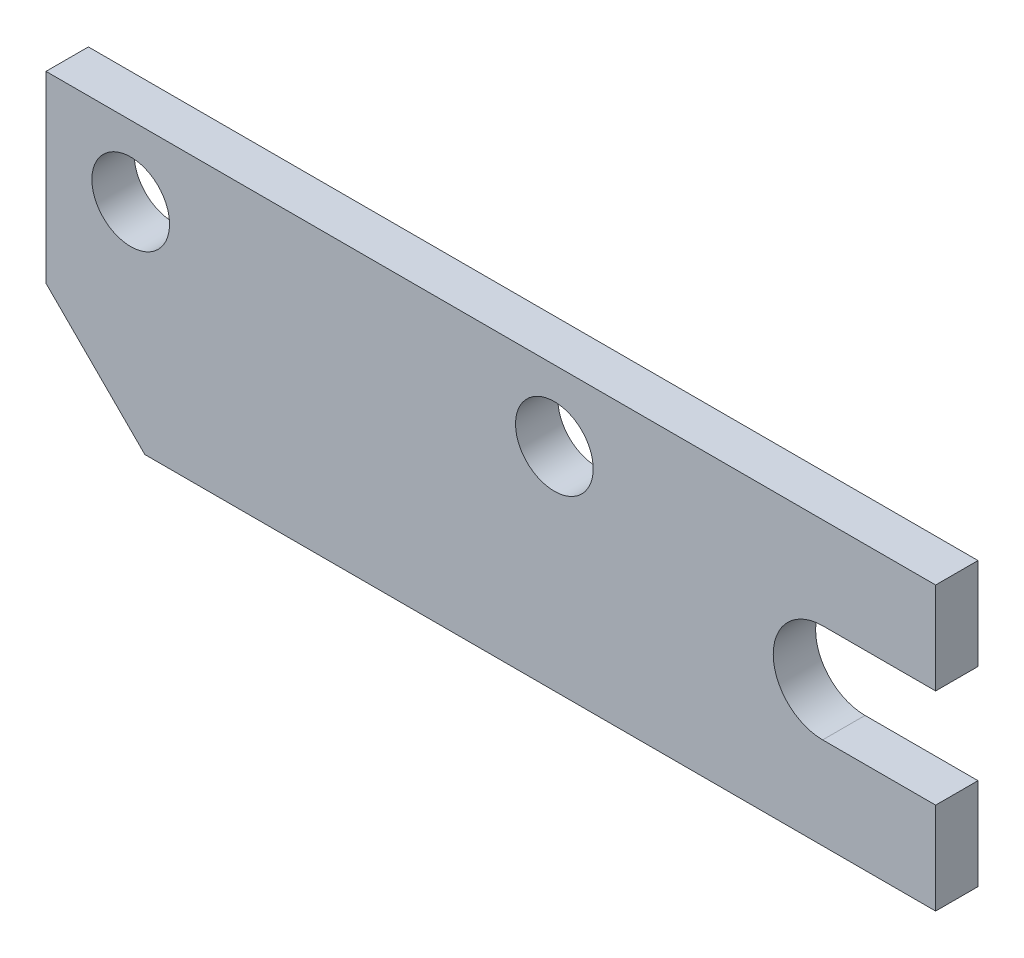
from build123d import *

# Parameters (mm, degrees)
SKETCH_1_W          = 63
SKETCH_1_H          = 20
EXTRUDE_1_DEPTH     = 3
HOLE_WIZARD_M5_1_D  = 5.5
CUT_EXTRUDE_1_DEPTH = 34.185087012
CHAMFER_1_SIZE      = 7


with BuildPart() as part:
    # 草图1 → 凸台-拉伸1 (new body)
    with BuildSketch(Plane.XY):
        Rectangle(SKETCH_1_W, SKETCH_1_H)
    extrude(amount=EXTRUDE_1_DEPTH)

    # M5 间隙孔1 (through all)
    with Locations(Plane(origin=(0, 0, 0), x_dir=(-1, 0, 0), z_dir=(0, 0, -1))):
        with Locations((25.5, 5), (-4.5, 5)):
            Hole(HOLE_WIZARD_M5_1_D / 2)

    # 草图5 → 切除-拉伸1 (cut, through all)
    with BuildSketch(Plane(origin=(0, 0, 0), x_dir=(-1, 0, 0), z_dir=(0, 0, -1))):
        with BuildLine():
            Line((-23.5, 3.5), (-31.5, 3.5))
            Line((-31.5, 3.5), (-31.5, -3.5))
            Line((-31.5, -3.5), (-23.5, -3.5))
            ThreePointArc((-23.5, -3.5), (-20, 0), (-23.5, 3.5))
        make_face()
    extrude(amount=-CUT_EXTRUDE_1_DEPTH, mode=Mode.SUBTRACT)

    # 倒角1
    chamfer_1_edges = [part.edges().sort_by_distance(p)[0] for p in [
        (-31.5, -10, 1.5),
    ]]
    chamfer(chamfer_1_edges, length=CHAMFER_1_SIZE)


solid = part.part
